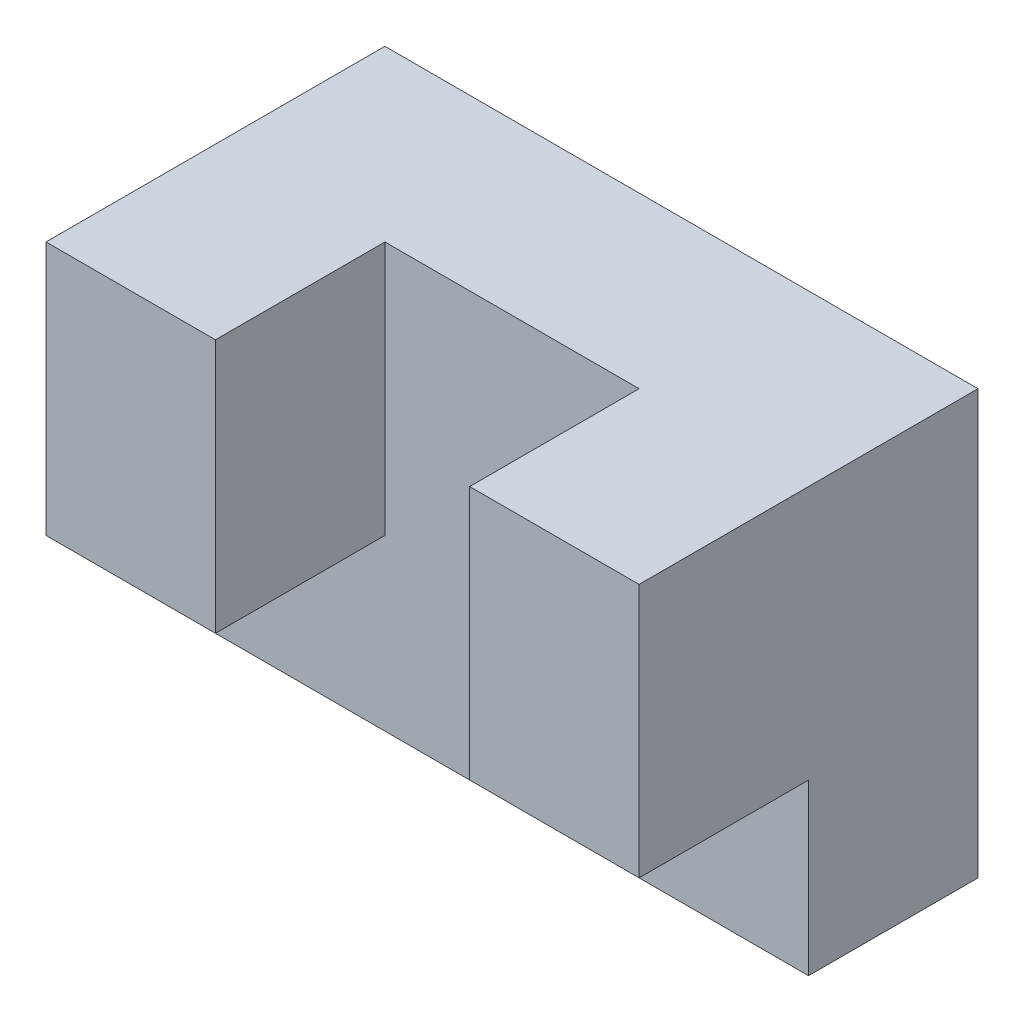
from build123d import *

# Parameters (mm, degrees)
CROQUIS2_W              = 70
CROQUIS2_H              = 50
SALIENTE_EXTRUIR1_DEPTH = 20
CROQUIS3_W              = 20
CROQUIS3_H              = 30
SALIENTE_EXTRUIR2_DEPTH = 20


with BuildPart() as part:
    # Croquis2 → Saliente-Extruir1 (new body)
    with BuildSketch(Plane.XY):
        Rectangle(CROQUIS2_W, CROQUIS2_H)
    extrude(amount=SALIENTE_EXTRUIR1_DEPTH)

    # Croquis3 → Saliente-Extruir2 (add)
    with BuildSketch(Plane.XY.offset(20)):
        with Locations((-25, 10)):
            Rectangle(CROQUIS3_W, CROQUIS3_H)
        with Locations((25, 10)):
            Rectangle(CROQUIS3_W, CROQUIS3_H)
    extrude(amount=SALIENTE_EXTRUIR2_DEPTH)


solid = part.part
